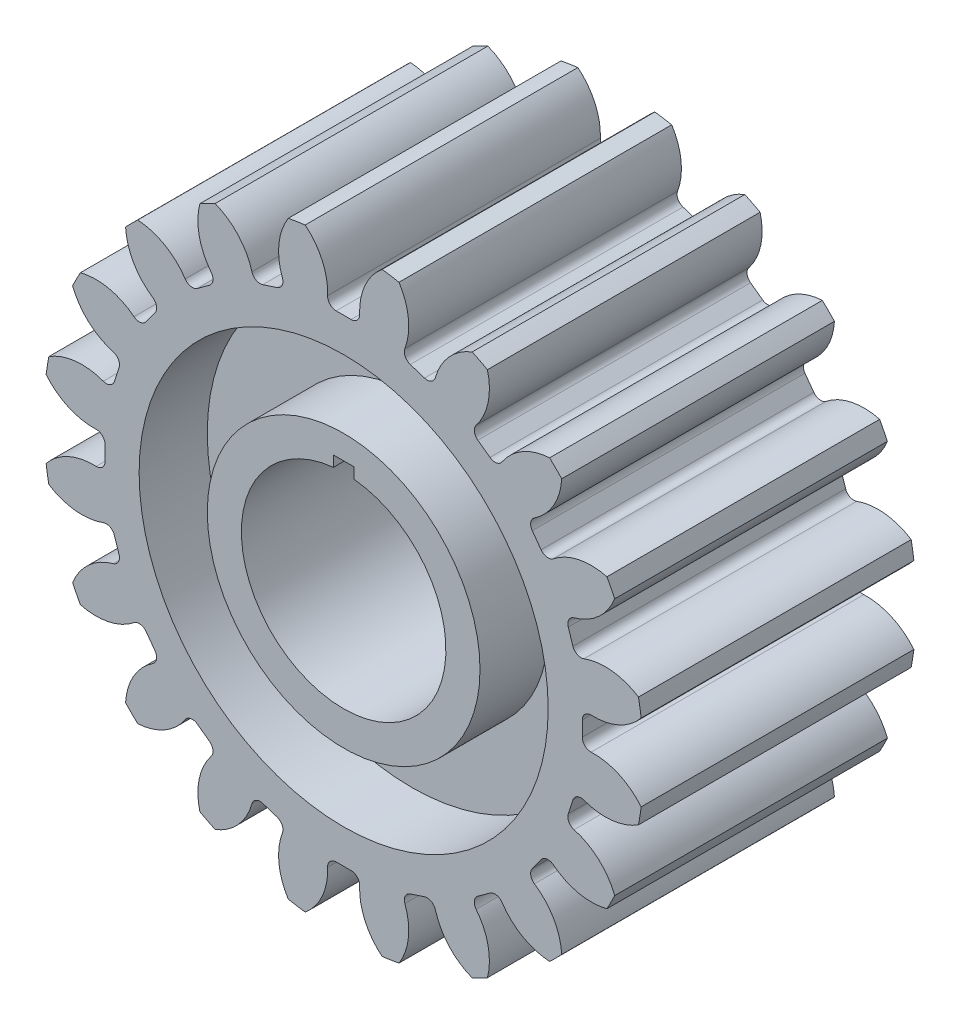
from build123d import *

# Parameters (mm, degrees)
SKETCH1_R                       = 22
GEAR_PROFILE_DEPTH              = 10
TEETH_PROFILE_DEPTH             = 37.986484018
TEETH_CIRCULAR_PATTERN_COUNT    = 20
GEAR_BORE_DEPTH                 = 37.770724425
SKETCH4_R                       = 15
SKETCH4_R_2                     = 10
WEIGHT_REDUCTION_POCKET_1_DEPTH = 5


with BuildPart() as part:
    # Sketch1 → Gear Profile (new, symmetric)
    with BuildSketch(Plane.XY):
        Circle(SKETCH1_R)
    extrude(amount=GEAR_PROFILE_DEPTH, both=True)

    # Sketch2 → Teeth Profile (cut, through all)
    with BuildSketch(Plane.XY.offset(10)):
        with BuildLine():
            Line((-0.55092361, 17.5), (0.55092361, 17.5))
            ThreePointArc((0.55092361, 17.5), (1.001895347, 17.692276656), (1.175390804, 18.150801625))
            ThreePointArc((1.175390804, 18.150801625), (1.56580944, 20.17854419), (2.8208, 21.81841166))
            ThreePointArc((2.8208, 21.81841166), (0, 22), (-2.8208, 21.81841166))
            ThreePointArc((-2.8208, 21.81841166), (-1.56580944, 20.17854419), (-1.175390804, 18.150801625))
            ThreePointArc((-1.175390804, 18.150801625), (-1.001895347, 17.692276656), (-0.55092361, 17.5))
        make_face()
    teeth_profile = extrude(amount=-TEETH_PROFILE_DEPTH, mode=Mode.SUBTRACT)

    # Teeth Circular Pattern: Teeth Profile ×20 about axis
    teeth_circular_pattern_axis = Axis((0, 0, 0), (0, 0, 1))
    for i in range(1, TEETH_CIRCULAR_PATTERN_COUNT):
        add(teeth_profile.rotate(teeth_circular_pattern_axis, i * 360 / TEETH_CIRCULAR_PATTERN_COUNT), mode=Mode.SUBTRACT)

    # Sketch3 → Gear Bore (cut, through all)
    with BuildSketch(Plane.XY.offset(10)):
        with BuildLine():
            Line((-0.75, 7.462405778), (-0.75, 8.25))
            Line((-0.75, 8.25), (0.75, 8.25))
            Line((0.75, 8.25), (0.75, 7.462405778))
            ThreePointArc((0.75, 7.462405778), (0, -7.5), (-0.75, 7.462405778))
        make_face()
    extrude(amount=-GEAR_BORE_DEPTH, mode=Mode.SUBTRACT)

    # Sketch4 → Weight reduction pocket 1 (cut)
    with BuildSketch(Plane.XY.offset(10)):
        Circle(SKETCH4_R)
        Circle(SKETCH4_R_2, mode=Mode.SUBTRACT)
    weight_reduction_pocket_1 = extrude(amount=-WEIGHT_REDUCTION_POCKET_1_DEPTH, mode=Mode.SUBTRACT)

    # Weight reduction pocket 2: Weight reduction pocket 1 across plane
    add(weight_reduction_pocket_1.mirror(Plane.XY), mode=Mode.SUBTRACT)


solid = part.part
